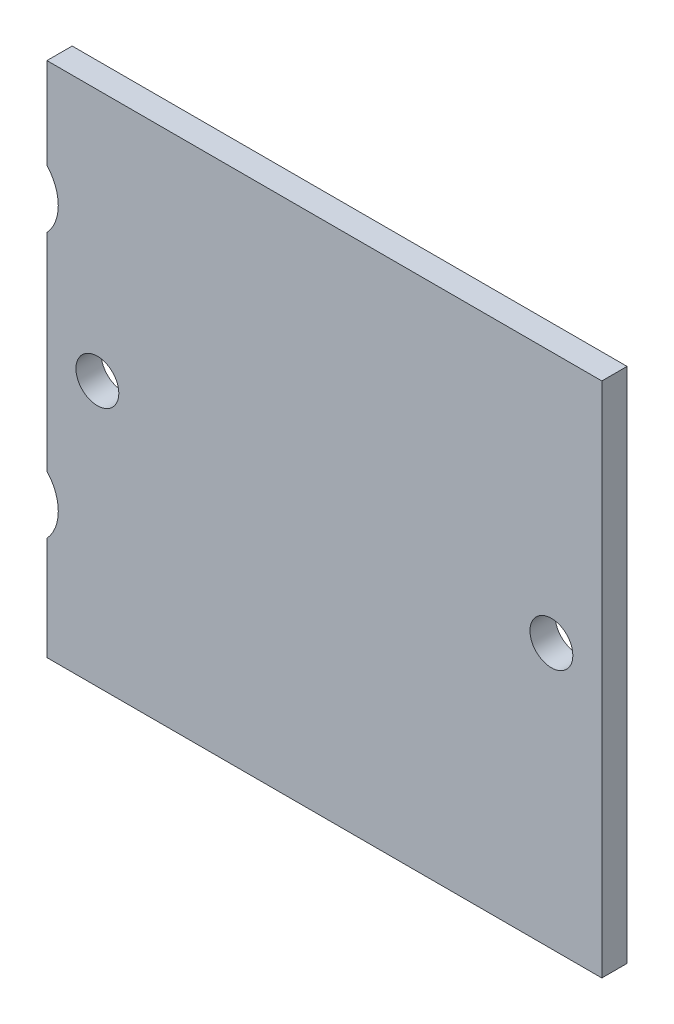
from build123d import *

# Parameters (mm, degrees)
MAIN_PROFILE_SKETCH_R = 1.7
MAIN_EXTRUSION_DEPTH  = 2


with BuildPart() as part:
    # Main Profile Sketch → Main Extrusion (new body)
    with BuildSketch(Plane.XY.offset(50.5)):
        with BuildLine():
            Line((178, 8.195656276), (178, -8.195656276))
            ThreePointArc((178, -8.195656276), (178.9, -10.5), (178, -12.804343724))
            Line((178, -12.804343724), (178, -21))
            Line((178, -21), (222, -21))
            Line((222, -21), (222, 20))
            Line((222, 20), (178, 20))
            Line((178, 20), (178, 12.804343724))
            ThreePointArc((178, 12.804343724), (178.9, 10.5), (178, 8.195656276))
        make_face()
        with Locations((182, 0)):
            Circle(MAIN_PROFILE_SKETCH_R, mode=Mode.SUBTRACT)
        with Locations((218, 0)):
            Circle(MAIN_PROFILE_SKETCH_R, mode=Mode.SUBTRACT)
    extrude(amount=-MAIN_EXTRUSION_DEPTH)


solid = part.part
